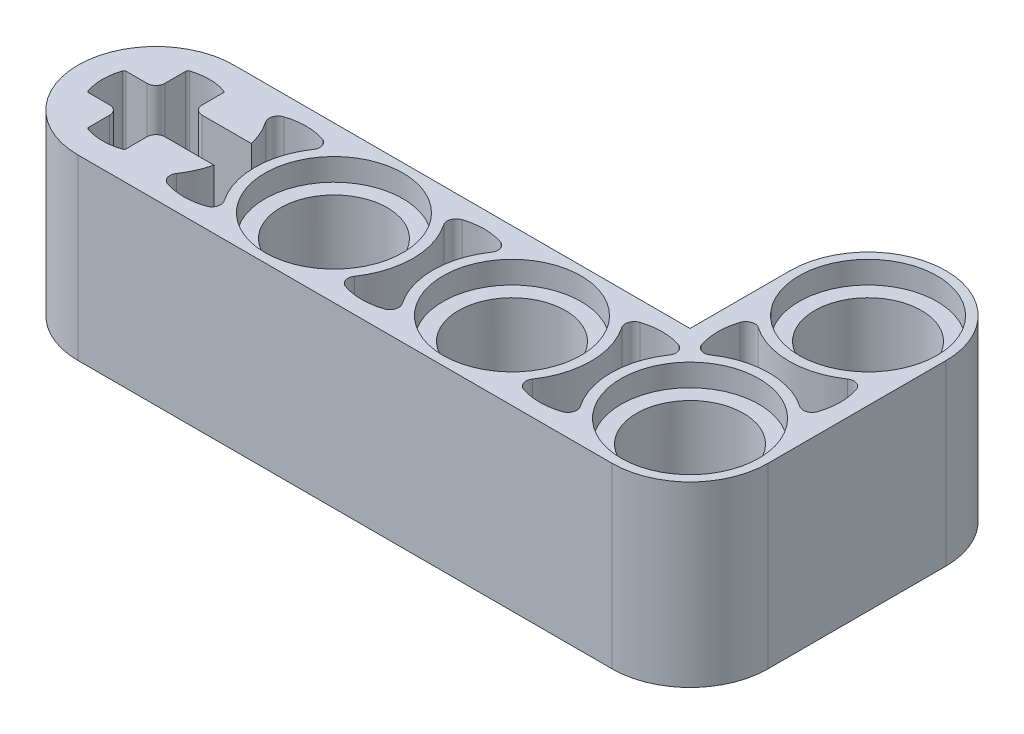
from build123d import *

# Parameters (mm, degrees)
BOSS_EXTRUDE1_DEPTH = 8
CUT_EXTRUDE1_DEPTH  = 8
SKETCH8_R           = 2.4
CUT_EXTRUDE4_DEPTH  = 21.892582416
SKETCH9_R           = 3.1
CUT_EXTRUDE5_DEPTH  = 1
CUT_EXTRUDE6_DEPTH  = 21.892582416
CUT_EXTRUDE7_DEPTH  = 21.892582416


with BuildPart() as part:
    # Sketch1 → Boss-Extrude1 (new body)
    with BuildSketch(Plane(origin=(0, 0, 0), x_dir=(1, 0, 0), z_dir=(0, 1, 0))):
        Polygon((-15.5, -3.5), (15.5, -3.5), (15.5, 3.5), (15.5, 11.5), (8.5, 11.5), (8.5, 3.5), (-15.5, 3.5), align=None)
    extrude(amount=BOSS_EXTRUDE1_DEPTH)

    # Sketch3 → Cut-Extrude1 (cut)
    with BuildSketch(Plane(origin=(0, 8, 0), x_dir=(1, 0, 0), z_dir=(0, 1, 0))):
        with BuildLine():
            ThreePointArc((-15.5, 0), (-14.474873734, 2.474873734), (-12, 3.5))
            Line((-12, 3.5), (-15.5, 3.5))
            Line((-15.5, 3.5), (-15.5, 0))
        make_face()
        with BuildLine():
            ThreePointArc((-12, -3.5), (-14.474873734, -2.474873734), (-15.5, 0))
            Line((-15.5, 0), (-15.5, -3.5))
            Line((-15.5, -3.5), (-12, -3.5))
        make_face()
        with BuildLine():
            ThreePointArc((15.5, 0), (14.474873734, -2.474873734), (12, -3.5))
            Line((12, -3.5), (15.5, -3.5))
            Line((15.5, -3.5), (15.5, 0))
        make_face()
        with BuildLine():
            Line((15.5, 11.5), (12, 11.5))
            ThreePointArc((12, 11.5), (14.474873734, 10.474873734), (15.5, 8))
            Line((15.5, 8), (15.5, 11.5))
        make_face()
        with BuildLine():
            Line((8.5, 11.5), (8.5, 8))
            ThreePointArc((8.5, 8), (9.525126266, 10.474873734), (12, 11.5))
            Line((12, 11.5), (8.5, 11.5))
        make_face()
    extrude(amount=-CUT_EXTRUDE1_DEPTH, mode=Mode.SUBTRACT)

    # Sketch8 → Cut-Extrude4 (cut, through all)
    with BuildSketch(Plane(origin=(0, 8, 0), x_dir=(1, 0, 0), z_dir=(0, 1, 0))):
        with Locations(Location((12, 8, 0), (0, 0, 270))):
            Circle(SKETCH8_R)
        with Locations(Location((12, 0, 0), (0, 0, 270))):
            Circle(SKETCH8_R)
        with Locations(Location((4, 0, 0), (0, 0, 270))):
            Circle(SKETCH8_R)
        with Locations(Location((-4, 0, 0), (0, 0, 270))):
            Circle(SKETCH8_R)
    extrude(amount=-CUT_EXTRUDE4_DEPTH, mode=Mode.SUBTRACT)

    # Sketch9 → Cut-Extrude5 (cut)
    with BuildSketch(Plane(origin=(0, 8, 0), x_dir=(1, 0, 0), z_dir=(0, 1, 0))):
        with Locations(Location((12, 8, 0), (0, 0, 270))):
            Circle(SKETCH9_R)
        with Locations(Location((12, 0, 0), (0, 0, 270))):
            Circle(SKETCH9_R)
        with Locations(Location((4, 0, 0), (0, 0, 270))):
            Circle(SKETCH9_R)
        with Locations(Location((-4, 0, 0), (0, 0, 270))):
            Circle(SKETCH9_R)
    cut_extrude5 = extrude(amount=-CUT_EXTRUDE5_DEPTH, mode=Mode.SUBTRACT)

    # Mirror1: Cut-Extrude5 across plane
    add(cut_extrude5.mirror(Plane.ZX.offset(4)), mode=Mode.SUBTRACT)

    # Sketch10 → Cut-Extrude6 (cut, through all)
    with BuildSketch(Plane(origin=(0, 8, 0), x_dir=(1, 0, 0), z_dir=(0, 1, 0))):
        with BuildLine():
            ThreePointArc((9.389900826, 4.865957447), (9.25, 4), (9.389900826, 3.134042553))
            ThreePointArc((9.389900826, 3.134042553), (9.641748912, 2.880966401), (9.995419806, 2.929873418))
            ThreePointArc((9.995419806, 2.929873418), (12, 3.55), (14.004580194, 2.929873418))
            ThreePointArc((14.004580194, 2.929873418), (14.358251088, 2.880966401), (14.610099174, 3.134042553))
            ThreePointArc((14.610099174, 3.134042553), (14.75, 4), (14.610099174, 4.865957447))
            ThreePointArc((14.610099174, 4.865957447), (14.358251088, 5.119033599), (14.004580194, 5.070126582))
            ThreePointArc((14.004580194, 5.070126582), (12, 4.45), (9.995419806, 5.070126582))
            ThreePointArc((9.995419806, 5.070126582), (9.641748912, 5.119033599), (9.389900826, 4.865957447))
        make_face()
        with BuildLine():
            ThreePointArc((7.134042553, -2.610099174), (8, -2.75), (8.865957447, -2.610099174))
            ThreePointArc((8.865957447, -2.610099174), (9.119033599, -2.358251088), (9.070126582, -2.004580194))
            ThreePointArc((9.070126582, -2.004580194), (8.45, 0), (9.070126582, 2.004580194))
            ThreePointArc((9.070126582, 2.004580194), (9.119033599, 2.358251088), (8.865957447, 2.610099174))
            ThreePointArc((8.865957447, 2.610099174), (8, 2.75), (7.134042553, 2.610099174))
            ThreePointArc((7.134042553, 2.610099174), (6.880966401, 2.358251088), (6.929873418, 2.004580194))
            ThreePointArc((6.929873418, 2.004580194), (7.55, 0), (6.929873418, -2.004580194))
            ThreePointArc((6.929873418, -2.004580194), (6.880966401, -2.358251088), (7.134042553, -2.610099174))
        make_face()
        with BuildLine():
            ThreePointArc((-0.865957447, -2.610099174), (0, -2.75), (0.865957447, -2.610099174))
            ThreePointArc((0.865957447, -2.610099174), (1.119033599, -2.358251088), (1.070126582, -2.004580194))
            ThreePointArc((1.070126582, -2.004580194), (0.45, 0), (1.070126582, 2.004580194))
            ThreePointArc((1.070126582, 2.004580194), (1.119033599, 2.358251088), (0.865957447, 2.610099174))
            ThreePointArc((0.865957447, 2.610099174), (0, 2.75), (-0.865957447, 2.610099174))
            ThreePointArc((-0.865957447, 2.610099174), (-1.119033599, 2.358251088), (-1.070126582, 2.004580194))
            ThreePointArc((-1.070126582, 2.004580194), (-0.45, 0), (-1.070126582, -2.004580194))
            ThreePointArc((-1.070126582, -2.004580194), (-1.119033599, -2.358251088), (-0.865957447, -2.610099174))
        make_face()
        with BuildLine():
            ThreePointArc((-8.865957447, -2.610099174), (-8, -2.75), (-7.134042553, -2.610099174))
            ThreePointArc((-7.134042553, -2.610099174), (-6.880966401, -2.358251088), (-6.929873418, -2.004580194))
            ThreePointArc((-6.929873418, -2.004580194), (-7.55, 0), (-6.929873418, 2.004580194))
            ThreePointArc((-6.929873418, 2.004580194), (-6.880966401, 2.358251088), (-7.134042553, 2.610099174))
            ThreePointArc((-7.134042553, 2.610099174), (-8, 2.75), (-8.865957447, 2.610099174))
            ThreePointArc((-8.865957447, 2.610099174), (-9.119033599, 2.358251088), (-9.070126582, 2.004580194))
            ThreePointArc((-9.070126582, 2.004580194), (-8.45, 0), (-9.070126582, -2.004580194))
            ThreePointArc((-9.070126582, -2.004580194), (-9.119033599, -2.358251088), (-8.865957447, -2.610099174))
        make_face()
    extrude(amount=-CUT_EXTRUDE6_DEPTH, mode=Mode.SUBTRACT)

    # Sketch11 → Cut-Extrude7 (cut, through all)
    with BuildSketch(Plane(origin=(0, 8, 0), x_dir=(1, 0, 0), z_dir=(0, 1, 0))):
        with BuildLine():
            Line((-13.24, 0.84), (-14.177705214, 0.84))
            ThreePointArc((-14.177705214, 0.84), (-14.235940121, 0.821293884), (-14.27238805, 0.772173913))
            ThreePointArc((-14.27238805, 0.772173913), (-14.4, 0), (-14.27238805, -0.772173913))
            ThreePointArc((-14.27238805, -0.772173913), (-14.235940121, -0.821293884), (-14.177705214, -0.84))
            Line((-14.177705214, -0.84), (-13.24, -0.84))
            ThreePointArc((-13.24, -0.84), (-12.957157288, -0.957157288), (-12.84, -1.24))
            Line((-12.84, -1.24), (-12.84, -2.177705214))
            ThreePointArc((-12.84, -2.177705214), (-12.821293884, -2.235940121), (-12.772173913, -2.27238805))
            ThreePointArc((-12.772173913, -2.27238805), (-12, -2.4), (-11.227826087, -2.27238805))
            ThreePointArc((-11.227826087, -2.27238805), (-11.178706116, -2.235940121), (-11.16, -2.177705214))
            Line((-11.16, -2.177705214), (-11.16, -1.24))
            ThreePointArc((-11.16, -1.24), (-11.042842712, -0.957157288), (-10.76, -0.84))
            Line((-10.76, -0.84), (-9.822294786, -0.84))
            Line((-9.822294786, -0.84), (-9.751800721, -0.84))
            Line((-9.751800721, -0.84), (-8.55081169, -0.84))
            ThreePointArc((-8.55081169, -0.84), (-8.45, 0), (-8.55081169, 0.84))
            Line((-8.55081169, 0.84), (-9.751800721, 0.84))
            Line((-9.751800721, 0.84), (-9.822294786, 0.84))
            Line((-9.822294786, 0.84), (-10.76, 0.84))
            ThreePointArc((-10.76, 0.84), (-11.042842712, 0.957157288), (-11.16, 1.24))
            Line((-11.16, 1.24), (-11.16, 2.177705214))
            ThreePointArc((-11.16, 2.177705214), (-11.178706116, 2.235940121), (-11.227826087, 2.27238805))
            ThreePointArc((-11.227826087, 2.27238805), (-12, 2.4), (-12.772173913, 2.27238805))
            ThreePointArc((-12.772173913, 2.27238805), (-12.821293884, 2.235940121), (-12.84, 2.177705214))
            Line((-12.84, 2.177705214), (-12.84, 1.24))
            ThreePointArc((-12.84, 1.24), (-12.957157288, 0.957157288), (-13.24, 0.84))
        make_face()
    extrude(amount=-CUT_EXTRUDE7_DEPTH, mode=Mode.SUBTRACT)


solid = part.part
